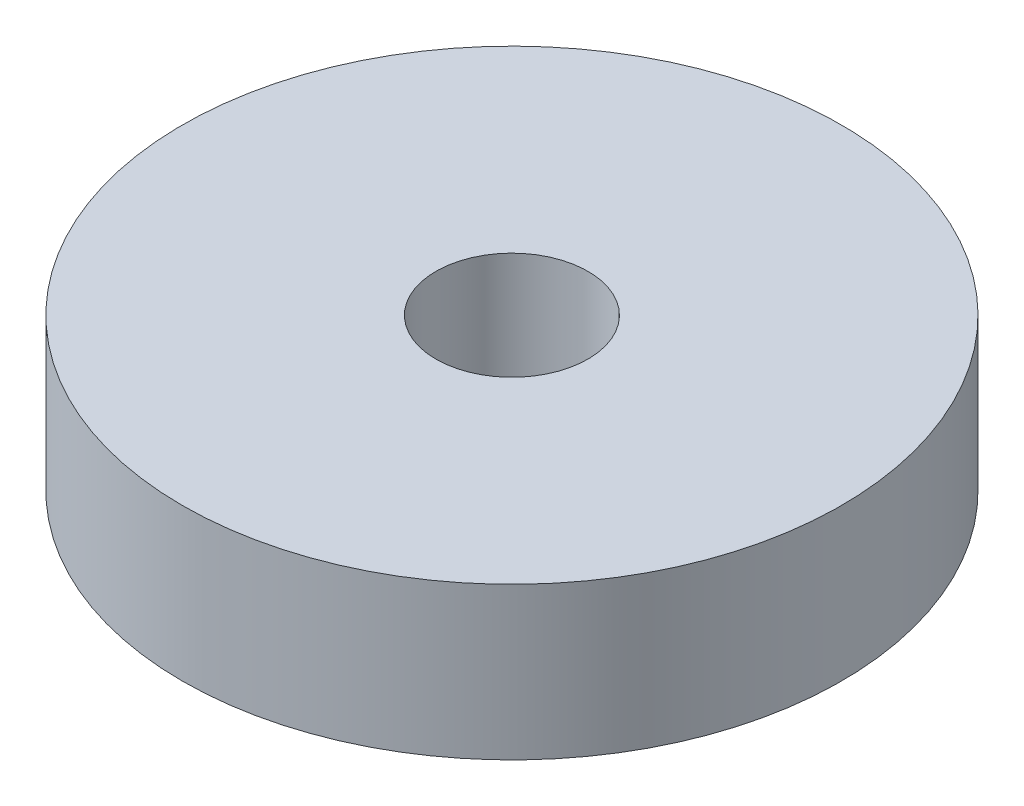
from build123d import *

# Parameters (mm, degrees)
SKETCH_1_R      = 32.5
SKETCH_1_R_2    = 7.5
EXTRUDE_1_DEPTH = 15


with BuildPart() as part:
    # 草圖1 → 填料-伸長1 (new body)
    with BuildSketch(Plane(origin=(0, 0, 0), x_dir=(1, 0, 0), z_dir=(0, 1, 0))):
        with Locations(Location((0, 0, 0), (0, 0, 270))):
            Circle(SKETCH_1_R)
        with Locations(Location((0, 0, 0), (0, 0, 270))):
            Circle(SKETCH_1_R_2, mode=Mode.SUBTRACT)
    extrude(amount=EXTRUDE_1_DEPTH)


solid = part.part
